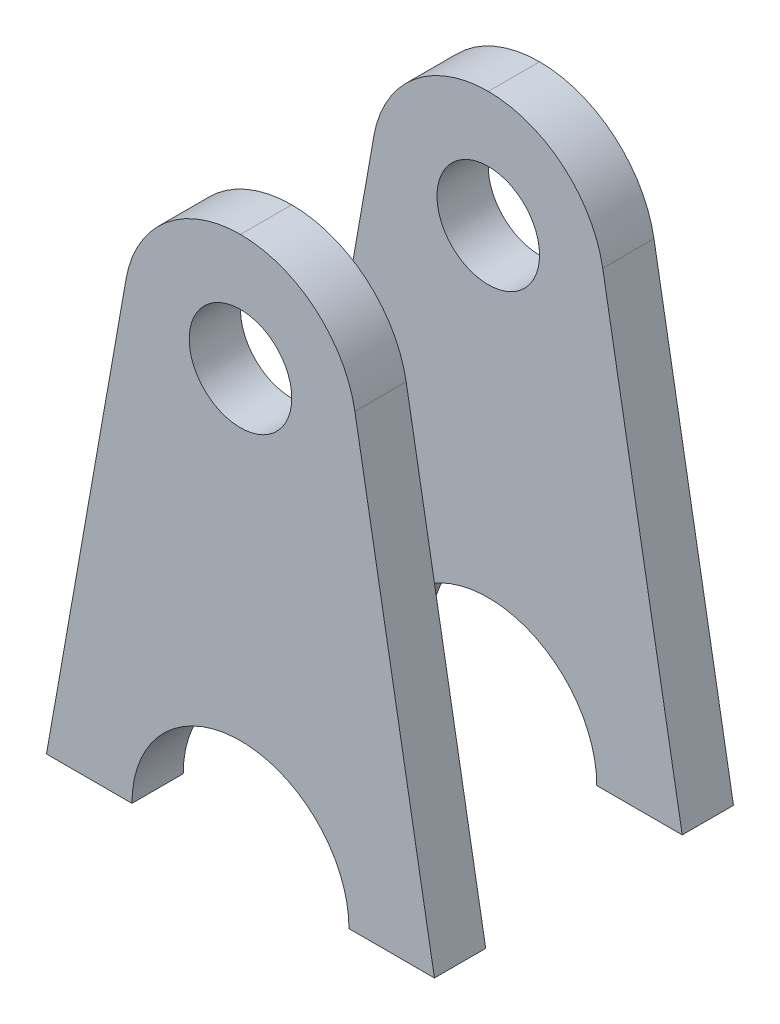
from build123d import *

# Parameters (mm, degrees)
SKETCH2_R           = 6
BOSS_EXTRUDE1_DEPTH = 6


with BuildPart() as part:
    # Sketch2 → Boss-Extrude1 (new body)
    with BuildSketch(Plane.XY):
        with BuildLine():
            Line((41.80598397, 52.774119162), (32.500482879, 0))
            Line((32.500482879, 0), (42.500482879, 0))
            ThreePointArc((42.500482879, 0), (55.200482879, 12.7), (67.900482879, 0))
            Line((67.900482879, 0), (77.900482879, 0))
            Line((77.900482879, 0), (68.594981787, 52.774119162))
            ThreePointArc((68.594981787, 52.774119162), (63.943507838, 60.830708372), (55.201596346, 64.012503946))
            Line((55.201596346, 64.012503946), (55.199369411, 64.012503946))
            ThreePointArc((55.199369411, 64.012503946), (46.457457919, 60.830708372), (41.80598397, 52.774119162))
        make_face()
        with Locations((55.201596346, 50.412503946)):
            Circle(SKETCH2_R, mode=Mode.SUBTRACT)
    extrude(amount=BOSS_EXTRUDE1_DEPTH)


with BuildPart() as body_2:
    # Mirror2: mirrored copy
    add(part.part.mirror(Plane(origin=(0, 0, -11.5), x_dir=(1, 0, 0), z_dir=(0, 0, -1))))


solid = Compound([part.part, body_2.part])
